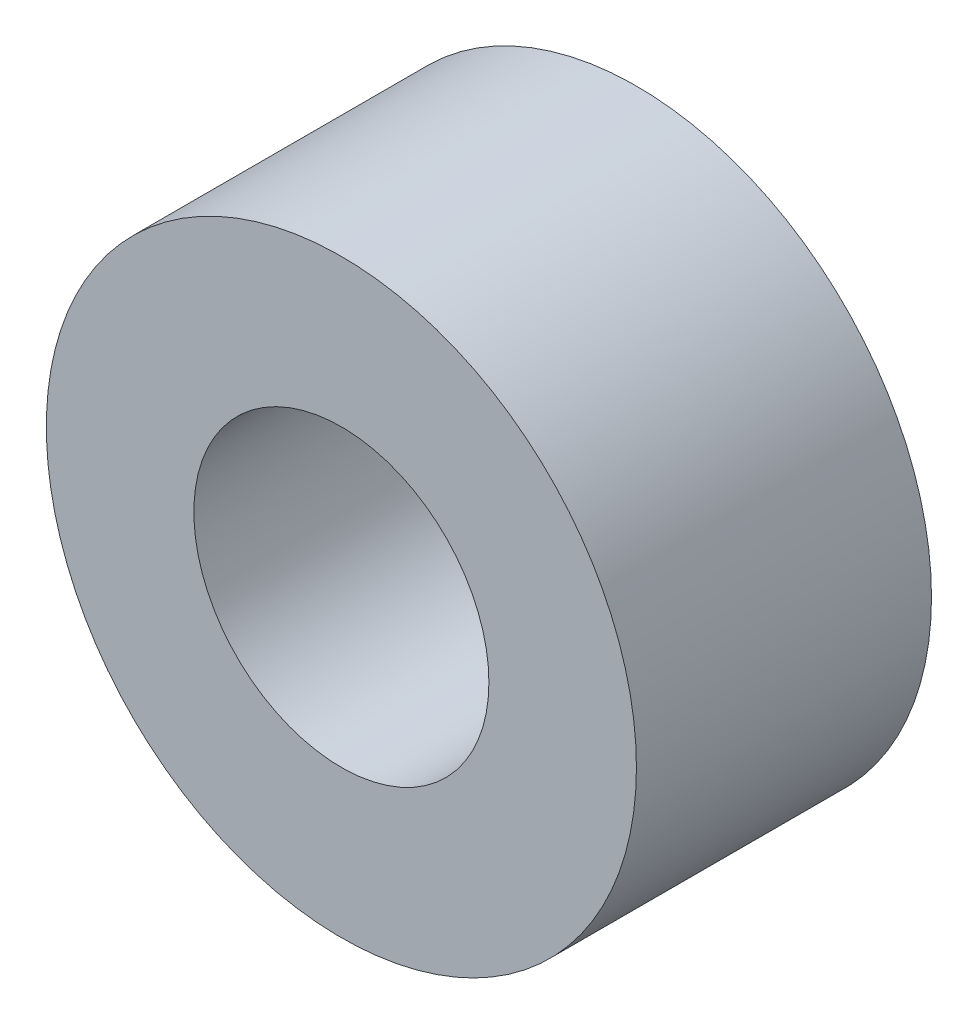
from build123d import *

# Parameters (mm, degrees)
SKETCH1_R           = 5
SKETCH1_R_2         = 2.5
BOSS_EXTRUDE1_DEPTH = 5


with BuildPart() as part:
    # Sketch1 → Boss-Extrude1 (new body)
    with BuildSketch(Plane.XY):
        Circle(SKETCH1_R)
        Circle(SKETCH1_R_2, mode=Mode.SUBTRACT)
    extrude(amount=BOSS_EXTRUDE1_DEPTH)


solid = part.part
